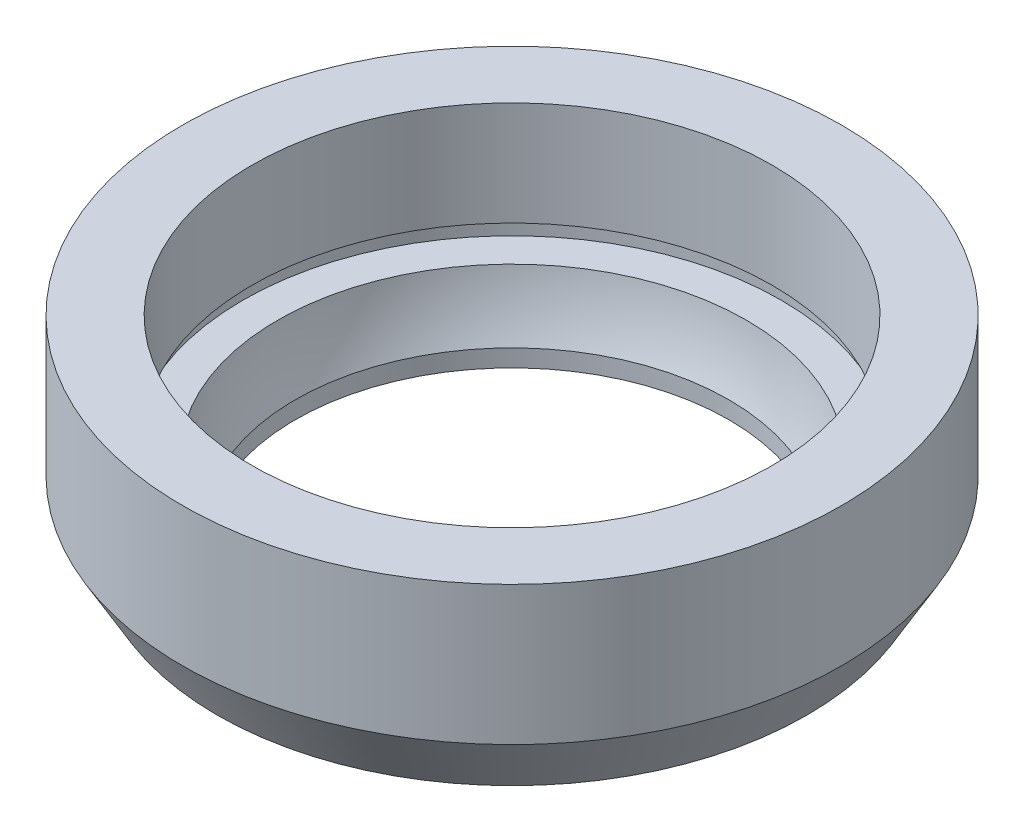
from build123d import *


with BuildPart() as part:
    # Esquisse1 → Révolution1 (revolve)
    with BuildSketch(Plane.XY, mode=Mode.PRIVATE) as r_volution1_sk:
        with BuildLine():
            Line((133.234412351, -151.511992469), (190, -151.511992469))
            Line((190, -151.511992469), (190, -71.511992469))
            Line((190, -71.511992469), (150, -71.511992469))
            Line((150, -71.511992469), (150, -131.511992469))
            Line((150, -131.511992469), (155.15, -131.511992469))
            Line((155.15, -131.511992469), (155.15, -141.511992469))
            Line((155.15, -141.511992469), (135.15, -141.511992469))
            ThreePointArc((135.15, -141.511992469), (134.28591859, -146.529943903), (133.234412351, -151.511992469))
        make_face()
        with BuildLine():
            Line((125, -176.15300862), (125, -186.15300862))
            Line((125, -186.15300862), (170, -186.15300862))
            Line((170, -186.15300862), (190, -151.511992469))
            Line((190, -151.511992469), (133.234412351, -151.511992469))
            ThreePointArc((133.234412351, -151.511992469), (129.707571602, -164.029785929), (125, -176.15300862))
        make_face()
    revolve(r_volution1_sk.sketch.rotate(Axis((0, -202.934552656, 0), (0, 1, 0)), 90), axis=Axis((0, -202.934552656, 0), (0, 1, 0)))


solid = part.part
